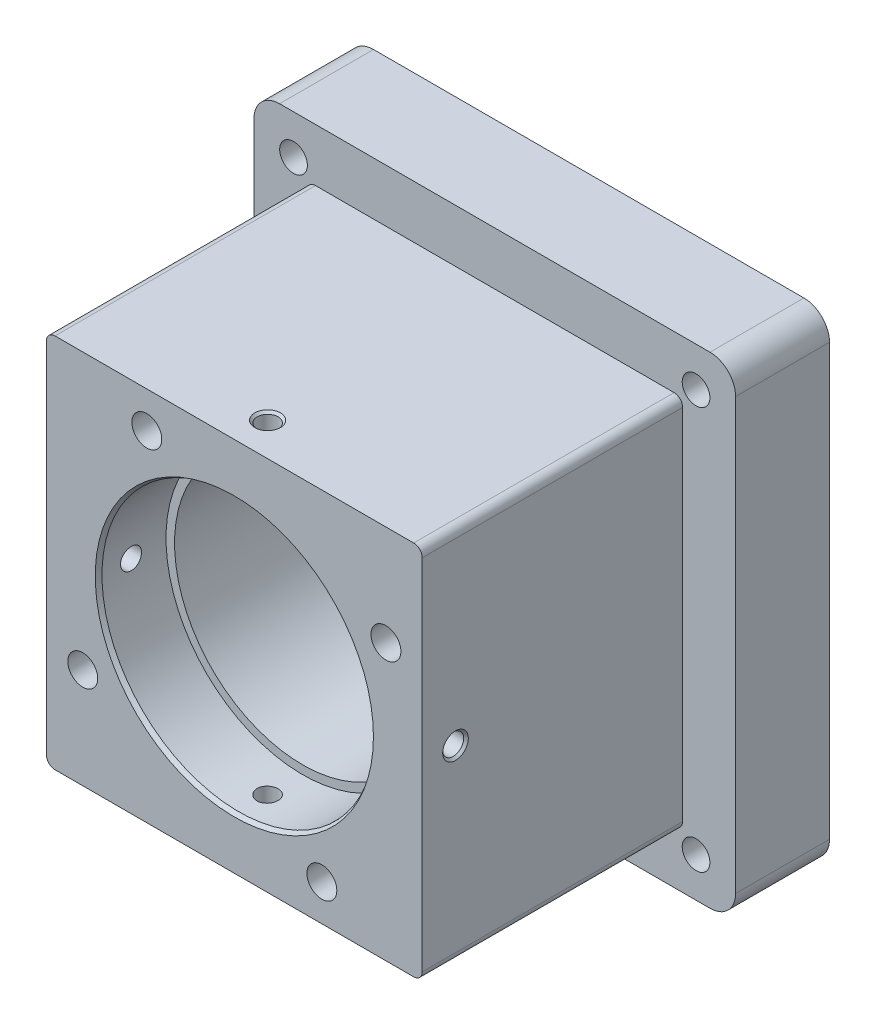
from build123d import *

# Parameters (mm, degrees)
BOSS_EXTRUDE1_DEPTH  = 11
BOSS_EXTRUDE2_DEPTH  = 41.5
SKETCH4_R            = 1.75
CUT_EXTRUDE1_DEPTH   = 3.5
LPATTERN1_COUNT      = 2
LPATTERN1_PITCH      = 28.991378029
LPATTERN1_COUNT_DIR2 = 2
LPATTERN1_PITCH_DIR2 = 28.991378029
LPATTERN2_COUNT      = 2
LPATTERN2_PITCH      = 47.14
LPATTERN2_COUNT_DIR2 = 2
LPATTERN2_PITCH_DIR2 = 47.14


with BuildPart() as part:
    # Sketch1 → Boss-Extrude1 (new body)
    with BuildSketch(Plane.XY):
        with BuildLine():
            Line((-25.2, -28.2), (25.2, -28.2))
            ThreePointArc((25.2, -28.2), (27.321320344, -27.321320344), (28.2, -25.2))
            Line((28.2, -25.2), (28.2, 25.2))
            ThreePointArc((28.2, 25.2), (27.321320344, 27.321320344), (25.2, 28.2))
            Line((25.2, 28.2), (-25.2, 28.2))
            ThreePointArc((-25.2, 28.2), (-27.321320344, 27.321320344), (-28.2, 25.2))
            Line((-28.2, 25.2), (-28.2, -25.2))
            ThreePointArc((-28.2, -25.2), (-27.321320344, -27.321320344), (-25.2, -28.2))
        make_face()
    extrude(amount=BOSS_EXTRUDE1_DEPTH)

    # Sketch2 → Boss-Extrude2 (add)
    with BuildSketch(Plane.XY):
        with BuildLine():
            Line((-21, -22), (21, -22))
            ThreePointArc((21, -22), (21.707106781, -21.707106781), (22, -21))
            Line((22, -21), (22, 21))
            ThreePointArc((22, 21), (21.707106781, 21.707106781), (21, 22))
            Line((21, 22), (-21, 22))
            ThreePointArc((-21, 22), (-21.707106781, 21.707106781), (-22, 21))
            Line((-22, 21), (-22, -21))
            ThreePointArc((-22, -21), (-21.707106781, -21.707106781), (-21, -22))
        make_face()
    extrude(amount=BOSS_EXTRUDE2_DEPTH)

    # Sketch3 → Cut-Revolve1 (revolve, cut)
    with BuildSketch(Plane(origin=(0, 0, 0), x_dir=(0, 0, -1), z_dir=(1, 0, 0))):
        Polygon((-41.5, 0), (-41.5, 16.288675135), (-41, 16), (-33.5, 16), (-33.5, 15), (-3, 15), (-3, 19.065), (-0.5, 19.065), (0, 19.565), (0, 0), align=None)
    revolve(axis=Axis((0, 0, 0), (0, 0, 1)), mode=Mode.SUBTRACT)

    # Sketch4 → Cut-Extrude1 (cut)
    with BuildSketch(Plane.XY.offset(41.5)):
        with Locations((17.753520778, 10.25)):
            Circle(SKETCH4_R)
    cut_extrude1 = extrude(amount=-CUT_EXTRUDE1_DEPTH, mode=Mode.SUBTRACT)

    # LPattern1: Cut-Extrude1 2 × 2
    with Locations(*[Vector(-0.9659258262890682, 0.2588190451025211, 0) * (i * LPATTERN1_PITCH) + Vector(-0.2588190451025206, -0.9659258262890683, 0) * (j * LPATTERN1_PITCH_DIR2) for i in range(LPATTERN1_COUNT) for j in range(LPATTERN1_COUNT_DIR2) if (i, j) != (0, 0)]):
        add(cut_extrude1, mode=Mode.SUBTRACT)

    # Sketch6 → Cut-Revolve2 (revolve, cut)
    with BuildSketch(Plane(origin=(23.57, 0, 0), x_dir=(0, 0, -1), z_dir=(1, 0, 0))):
        Polygon((-11.935884786, 23.57), (-11, 25.191), (-0.379, 25.191), (0, 25.57), (0, 23.57), align=None)
    cut_revolve2 = revolve(axis=Axis((23.57, 23.57, 0), (0, 0, 1)), mode=Mode.SUBTRACT)

    # LPattern2: Cut-Revolve2 2 × 2
    with Locations(*[(-i * LPATTERN2_PITCH, -j * LPATTERN2_PITCH_DIR2, 0) for i in range(LPATTERN2_COUNT) for j in range(LPATTERN2_COUNT_DIR2) if (i, j) != (0, 0)]):
        add(cut_revolve2, mode=Mode.SUBTRACT)

    # Sketch8 → Cut-Revolve3 (revolve, cut)
    with BuildSketch(Plane.XY.offset(37.6)):
        Polygon((-22, 0), (-22, 1.5), (-21.7295, 1.2295), (-15.8, 1.2295), (-15.8, 0), align=None)
    revolve(axis=Axis((-15.8, 0, 37.6), (-1, 0, 0)), mode=Mode.SUBTRACT)

    # Sketch9 → Cut-Revolve4 (revolve, cut)
    with BuildSketch(Plane.XY.offset(37.6)):
        Polygon((0, -22), (-1.5, -22), (-1.2295, -21.7295), (-1.2295, -15.8), (0, -15.8), align=None)
    revolve(axis=Axis((0, -15.8, 37.6), (0, -1, 0)), mode=Mode.SUBTRACT)

    # Sketch10 → Cut-Revolve5 (revolve, cut)
    with BuildSketch(Plane.XY.offset(37.6)):
        Polygon((22, 0), (22, -1.5), (21.7295, -1.2295), (15.8, -1.2295), (15.8, 0), align=None)
    revolve(axis=Axis((15.8, 0, 37.6), (1, 0, 0)), mode=Mode.SUBTRACT)

    # Sketch11 → Cut-Revolve6 (revolve, cut)
    with BuildSketch(Plane.XY.offset(37.6)):
        Polygon((0, 22), (1.5, 22), (1.2295, 21.7295), (1.2295, 15.8), (0, 15.8), align=None)
    revolve(axis=Axis((0, 15.8, 37.6), (0, 1, 0)), mode=Mode.SUBTRACT)


solid = part.part
